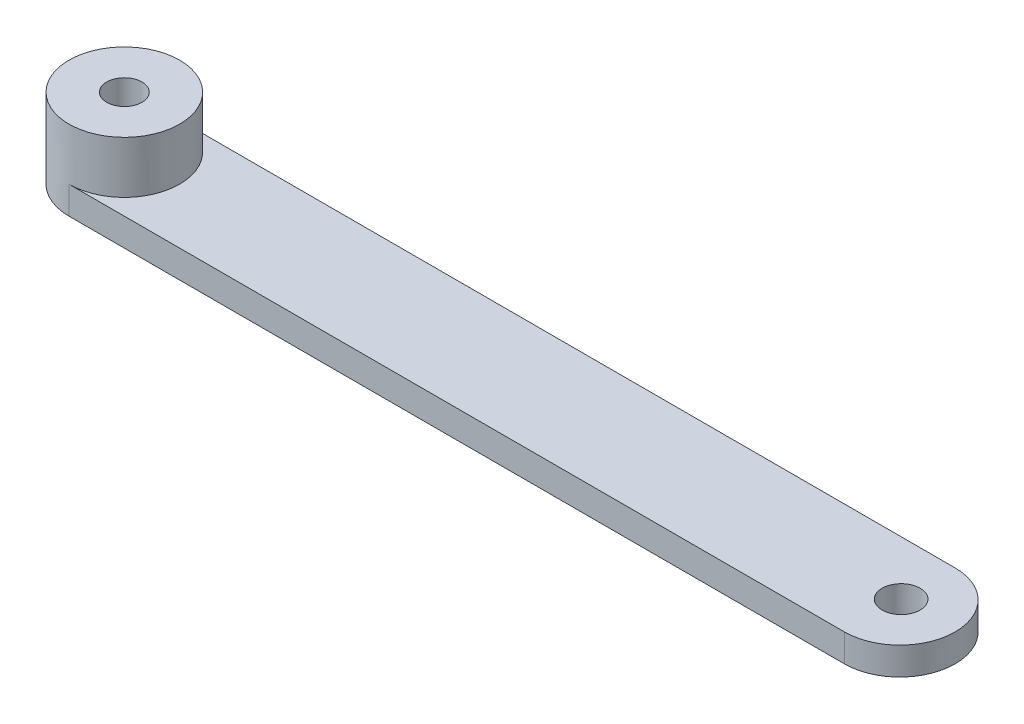
from build123d import *

# Parameters (mm, degrees)
BOSS_EXTRUDE1_DEPTH = 3.175
SKETCH2_R           = 2.175
CUT_EXTRUDE1_DEPTH  = 12.7
SKETCH3_R           = 2.021658142
BOSS_EXTRUDE2_DEPTH = 5.9625


with BuildPart() as part:
    # Sketch1 → Boss-Extrude1 (new body)
    with BuildSketch(Plane(origin=(0, 0, 0), x_dir=(1, 0, 0), z_dir=(0, 1, 0))):
        with BuildLine():
            Line((-23.171929825, 5.625877193), (65.728070175, 5.625877193))
            ThreePointArc((65.728070175, 5.625877193), (72.078070175, -0.724122807), (65.728070175, -7.074122807))
            Line((65.728070175, -7.074122807), (-23.171929825, -7.074122807))
            ThreePointArc((-23.171929825, -7.074122807), (-29.521929825, -0.724122807), (-23.171929825, 5.625877193))
        make_face()
    extrude(amount=BOSS_EXTRUDE1_DEPTH)

    # Sketch2 → Cut-Extrude1 (cut)
    with BuildSketch(Plane(origin=(0, 3.175, 0), x_dir=(1, 0, 0), z_dir=(0, 1, 0))):
        with Locations(Location((-23.171929825, -0.570780949, 0), (0, 0, 270))):
            Circle(SKETCH2_R)
        with Locations(Location((65.728070175, -0.570780949, 0), (0, 0, 270))):
            Circle(SKETCH2_R)
    extrude(amount=-CUT_EXTRUDE1_DEPTH, mode=Mode.SUBTRACT)

    # Sketch3 → Boss-Extrude2 (add)
    with BuildSketch(Plane(origin=(0, 3.175, 0), x_dir=(1, 0, 0), z_dir=(0, 1, 0))):
        with BuildLine():
            ThreePointArc((-23.171929825, 5.625877193), (-29.521929825, -0.724122807), (-23.171929825, -7.074122807))
            ThreePointArc((-23.171929825, -7.074122807), (-16.821929825, -0.724122807), (-23.171929825, 5.625877193))
        make_face()
        with Locations(Location((-23.171929825, -0.724122807, 0), (0, 0, 270))):
            Circle(SKETCH3_R, mode=Mode.SUBTRACT)
    extrude(amount=BOSS_EXTRUDE2_DEPTH)


solid = part.part
